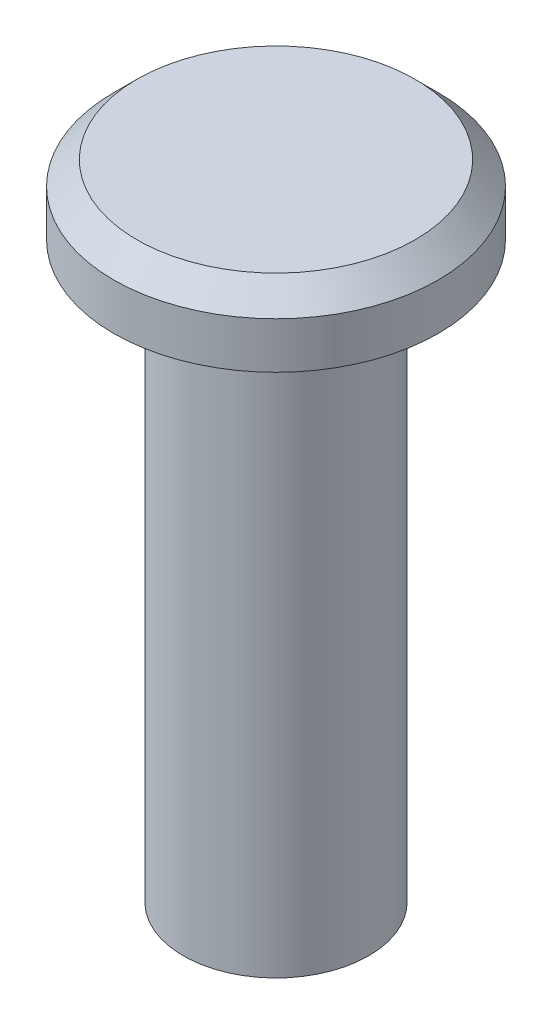
from build123d import *


with BuildPart() as part:
    # Sketch1 → Revolve1 (revolve)
    with BuildSketch(Plane.XY, mode=Mode.PRIVATE) as revolve1_sk:
        Polygon((0, 0), (4, 0), (4, 24.75), (7, 24.75), (7, 26.75), (6, 27.75), (0, 27.75), align=None)
    revolve(revolve1_sk.sketch.rotate(Axis((0, 33.604972013, 0), (0, -1, 0)), 180), axis=Axis((0, 33.604972013, 0), (0, -1, 0)))


solid = part.part
